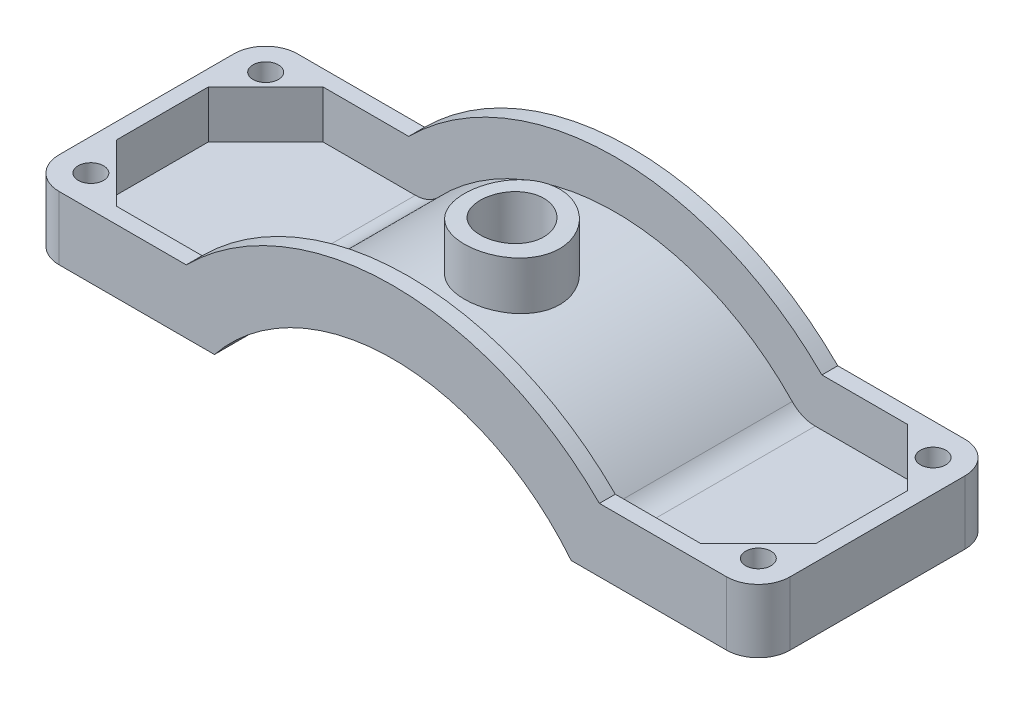
from build123d import *

# Parameters (mm, degrees)
EXTRUDE_1_DEPTH          = 75
SHELL_1_T                = -5
FILLET_1_R               = 10
EXTRUDE_2_DEPTH          = 20
FILLET_2_R               = 10
EXTRUDE_3_DEPTH          = 20
SKETCH_5_R               = 4
CUT_EXTRUDE_1_DEPTH      = 15
EXTRUDE_4_DEPTH          = 15
EXTRUDE_4_DEPTH_BACK     = 5
SKETCH_6_R               = 15
SKETCH_6_R_2             = 10
SKETCH_6_3_R             = 10
CUT_EXTRUDE_2_DEPTH      = 15
CUT_EXTRUDE_3_DEPTH      = 247.831926653
CUT_EXTRUDE_3_DEPTH_BACK = 274


with BuildPart() as part:
    # 스케치2 → 보스-돌출1 (new body)
    with BuildSketch(Plane.XY):
        with BuildLine():
            Line((0, 0), (58.881338846, 0))
            ThreePointArc((58.881338846, 0), (115, 26.892396757), (171.118661154, 0))
            Line((171.118661154, 0), (230, 0))
            Line((230, 0), (230, 20))
            Line((230, 20), (180, 20))
            ThreePointArc((180, 20), (115, 46.892396757), (50, 20))
            Line((50, 20), (0, 20))
            Line((0, 20), (0, 0))
        make_face()
    extrude(amount=EXTRUDE_1_DEPTH)

    # 쉘1
    shell_1_openings = [part.faces().sort_by_distance(p)[0] for p in [
        (205, 20, 37.5),
        (115, 46.892396757, 37.5),
        (25, 20, 37.5),
    ]]
    offset(amount=SHELL_1_T, openings=shell_1_openings, kind=Kind.INTERSECTION)

    # 필렛1
    fillet_1_edges = [part.edges().sort_by_distance(p)[0] for p in [
        (173.465614657, 5, 37.5),
        (56.534385343, 5, 37.5),
    ]]
    fillet(fillet_1_edges, radius=FILLET_1_R)

    # 스케치3 → 보스-돌출2 (add)
    with BuildSketch(Plane(origin=(0, 20, 0), x_dir=(1, 0, 0), z_dir=(0, 1, 0))):
        Polygon((5, -5), (5, -23.013509492), (23.013509492, -5), align=None)
        Polygon((23.013509492, -70), (5, -51.986490508), (5, -70), align=None)
    extrude(amount=-EXTRUDE_2_DEPTH)

    # 필렛2
    fillet_2_edges = [part.edges().sort_by_distance(p)[0] for p in [
        (230, 10, 0),
        (230, 10, 75),
        (0, 10, 0),
        (0, 10, 75),
    ]]
    fillet(fillet_2_edges, radius=FILLET_2_R)

    # 스케치3<3> → 보스-돌출3 (add)
    with BuildSketch(Plane(origin=(0, 20, 0), x_dir=(1, 0, 0), z_dir=(0, 1, 0))):
        Polygon((206.986490508, -5), (225, -23.013509492), (225, -5), align=None)
        Polygon((206.986490508, -70), (225, -70), (225, -51.986490508), align=None)
    extrude(amount=-EXTRUDE_3_DEPTH)

    # 스케치5 → 컷-돌출1 (cut)
    with BuildSketch(Plane(origin=(0, 20, 0), x_dir=(1, 0, 0), z_dir=(0, 1, 0))):
        with Locations((10, -10)):
            Circle(SKETCH_5_R)
        with Locations((10, -65)):
            Circle(SKETCH_5_R)
        with Locations((220, -65)):
            Circle(SKETCH_5_R)
        with Locations((220, -10)):
            Circle(SKETCH_5_R)
    extrude(amount=-CUT_EXTRUDE_1_DEPTH, mode=Mode.SUBTRACT)

    # 스케치6<3> → 컷-돌출2 (cut)
    with BuildSketch(Plane(origin=(0, 34, 0), x_dir=(1, 0, 0), z_dir=(0, 1, 0))):
        with Locations((115, -37.5)):
            Circle(SKETCH_6_3_R)
    extrude(amount=-CUT_EXTRUDE_2_DEPTH, mode=Mode.SUBTRACT)


with BuildPart() as body_2:
    # 스케치6 → 보스-돌출4 (new, two sides: drawn at the far end of the back side and taken through both)
    with BuildSketch(Plane(origin=(0, 34, 0), x_dir=(1, 0, 0), z_dir=(0, 1, 0)).offset(-EXTRUDE_4_DEPTH_BACK)):
        with Locations((115, -37.5)):
            Circle(SKETCH_6_R)
        with Locations((115, -37.5)):
            Circle(SKETCH_6_R_2, mode=Mode.SUBTRACT)
    extrude(amount=EXTRUDE_4_DEPTH + EXTRUDE_4_DEPTH_BACK)

    # 스케치7 → 컷-돌출3 (cut, two sides: drawn at the far end of the back side and taken through both)
    with BuildSketch(Plane.XY.offset(75).offset(-CUT_EXTRUDE_3_DEPTH_BACK)):
        with BuildLine():
            Line((50, 85.485358055), (50, 20))
            ThreePointArc((50, 20), (115, 46.892396757), (180, 20))
            Line((180, 20), (180, 85.485358055))
            Line((180, 85.485358055), (50, 85.485358055))
        make_face()
    extrude(amount=CUT_EXTRUDE_3_DEPTH + CUT_EXTRUDE_3_DEPTH_BACK, mode=Mode.SUBTRACT)


solid = Compound([part.part, body_2.part])
